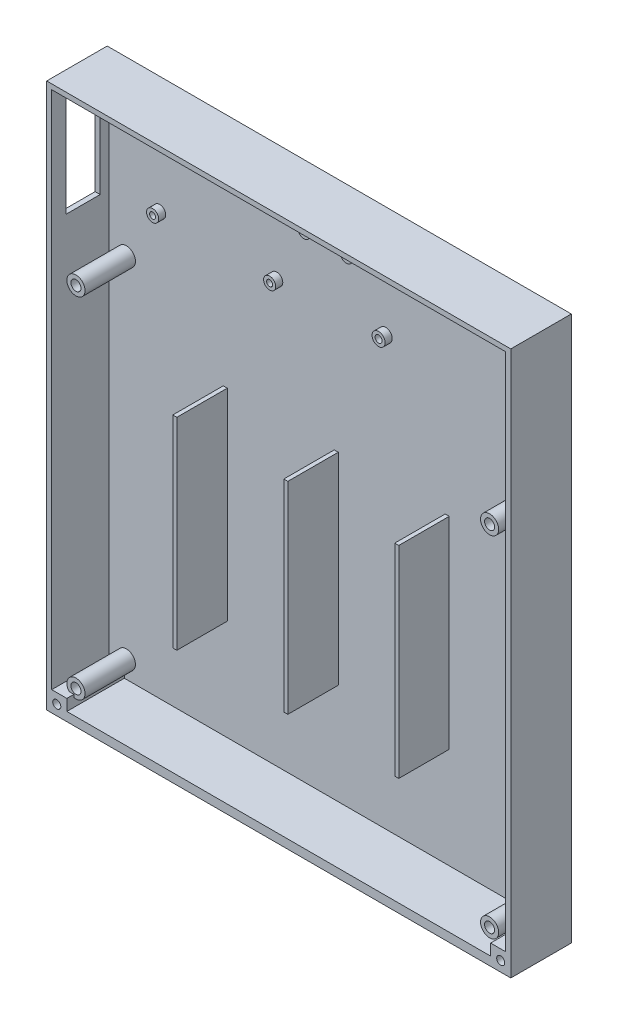
from build123d import *

# Parameters (mm, degrees)
ESQUISSE1_W             = 230
ESQUISSE1_H             = 270
BOSS_EXTRU_1_DEPTH      = 5
ESQUISSE2_R             = 2
ESQUISSE2_R_2           = 1.75
ESQUISSE2_R_3           = 1.5
ENL_V_MAT_EXTRU_1_DEPTH = 5
COQUE3_T                = -1.5
ESQUISSE3_R             = 4.5
ESQUISSE3_R_2           = 2.5
BOSS_EXTRU_3_DEPTH      = 25
ESQUISSE4_W             = 1
ESQUISSE4_H             = 267
BOSS_EXTRU_4_DEPTH      = 3.5
ESQUISSE5_W             = 225
ESQUISSE5_H             = 1
ESQUISSE5_H_2           = 2.9
BOSS_EXTRU_10_DEPTH     = 3.5
ESQUISSE7_W             = 2
ESQUISSE7_H             = 100
BOSS_EXTRU_11_DEPTH     = 25
ESQUISSE8_W             = 230
ESQUISSE8_H             = 270
ESQUISSE8_W_2           = 225
ESQUISSE8_H_2           = 263.1
BOSS_EXTRU_12_DEPTH     = 25
ESQUISSE13_W            = 17
ESQUISSE13_H            = 55
ENL_V_MAT_EXTRU_4_DEPTH = 10
ESQUISSE16_W            = 7.5
ESQUISSE16_H            = 5.6
BOSS_EXTRU_13_DEPTH     = 28.5
ESQUISSE17_R            = 2
ENL_V_MAT_EXTRU_5_DEPTH = 213.83636063


with BuildPart() as part:
    # Esquisse1 → Boss.-Extru.1 (new body)
    with BuildSketch(Plane.XY):
        with Locations((0, -41.5625)):
            Rectangle(ESQUISSE1_W, ESQUISSE1_H)
    extrude(amount=BOSS_EXTRU_1_DEPTH)

    # Esquisse2 → Enlèv. mat.-Extru.1 (cut)
    with BuildSketch(Plane.XY.offset(5)):
        with Locations((-104, -163.5625)):
            Circle(ESQUISSE2_R)
        with Locations(Location((-104, 9.4375, 0), (0, 0, 180))):
            Circle(ESQUISSE2_R)
        with Locations((104.5, 82.9375)):
            Circle(ESQUISSE2_R_2)
        with Locations((24.5, 82.9375)):
            Circle(ESQUISSE2_R_2)
        with Locations(Location((24.5, 39.9375, 0), (0, 0, 180))):
            Circle(ESQUISSE2_R_2)
        with Locations(Location((104.5, 39.9375, 0), (0, 0, 180))):
            Circle(ESQUISSE2_R_2)
        with Locations((-87.5, 85.9375)):
            Circle(ESQUISSE2_R_3)
        with Locations(Location((-29.5, 85.9375, 0), (0, 0, 180))):
            Circle(ESQUISSE2_R_3)
        with Locations((8.5, 67.4375)):
            Circle(ESQUISSE2_R_3)
        with Locations(Location((-12.5, 67.4375, 0), (0, 0, 180))):
            Circle(ESQUISSE2_R_3)
        with Locations((-12.5, 79.9375)):
            Circle(ESQUISSE2_R_3)
        with Locations(Location((8.5, 79.9375, 0), (0, 0, 180))):
            Circle(ESQUISSE2_R_3)
        with Locations(Location((101, -163.5625, 0), (0, 0, 180))):
            Circle(ESQUISSE2_R)
        with Locations((101, 9.4375)):
            Circle(ESQUISSE2_R)
        with Locations(Location((-87.5, 36.9375, 0), (0, 0, 180))):
            Circle(ESQUISSE2_R_3)
        with Locations((-29.5, 36.9375)):
            Circle(ESQUISSE2_R_3)
    extrude(amount=-ENL_V_MAT_EXTRU_1_DEPTH, mode=Mode.SUBTRACT)

    # Coque3
    coque3_openings = [part.faces().sort_by_distance(p)[0] for p in [
        (-0.011238138, -41.697281592, 5),
    ]]
    offset(amount=COQUE3_T, openings=coque3_openings, kind=Kind.INTERSECTION)

    # Esquisse3 → Boss.-Extru.3 (add)
    # profile 1 of 4: a face of its own
    with BuildSketch(Plane.XY.offset(1.5)):
        with Locations(Location((-104, 9.4375, 0), (0, 0, 180))):
            Circle(ESQUISSE3_R)
        with Locations(Location((-104, 9.4375, 0), (0, 0, 180))):
            Circle(ESQUISSE3_R_2, mode=Mode.SUBTRACT)
    # profile 2 of 4: a face of its own
    with BuildSketch(Plane.XY.offset(1.5)):
        with Locations(Location((-104, -163.5625, 0), (0, 0, 180))):
            Circle(ESQUISSE3_R)
        with Locations(Location((-104, -163.5625, 0), (0, 0, 180))):
            Circle(ESQUISSE3_R_2, mode=Mode.SUBTRACT)
    # profile 3 of 4: a face of its own
    with BuildSketch(Plane.XY.offset(1.5)):
        with Locations(Location((101, -163.5625, 0), (0, 0, 180))):
            Circle(ESQUISSE3_R)
        with Locations(Location((101, -163.5625, 0), (0, 0, 180))):
            Circle(ESQUISSE3_R_2, mode=Mode.SUBTRACT)
    # profile 4 of 4: a face of its own
    with BuildSketch(Plane.XY.offset(1.5)):
        with Locations(Location((101, 9.4375, 0), (0, 0, 180))):
            Circle(ESQUISSE3_R)
        with Locations(Location((101, 9.4375, 0), (0, 0, 180))):
            Circle(ESQUISSE3_R_2, mode=Mode.SUBTRACT)
    extrude(amount=BOSS_EXTRU_3_DEPTH)

    # Esquisse4 → Boss.-Extru.4 (add)
    with BuildSketch(Plane.XY.offset(1.5)):
        with Locations((-113, -41.5625)):
            Rectangle(ESQUISSE4_W, ESQUISSE4_H)
        with Locations((113, -41.5625)):
            Rectangle(ESQUISSE4_W, ESQUISSE4_H)
    extrude(amount=BOSS_EXTRU_4_DEPTH)

    # Esquisse5 → Boss.-Extru.10 (add)
    with BuildSketch(Plane.XY.offset(1.5)):
        with Locations((0, 91.4375)):
            Rectangle(ESQUISSE5_W, ESQUISSE5_H)
        with Locations((0, -173.6125)):
            Rectangle(ESQUISSE5_W, ESQUISSE5_H_2)
    extrude(amount=BOSS_EXTRU_10_DEPTH)

    # Esquisse7 → Boss.-Extru.11 (add)
    with BuildSketch(Plane.XY.offset(1.5)):
        with Locations((0, -72.1625)):
            Rectangle(ESQUISSE7_W, ESQUISSE7_H)
        with Locations((-55, -72.1625)):
            Rectangle(ESQUISSE7_W, ESQUISSE7_H)
        with Locations((55, -72.1625)):
            Rectangle(ESQUISSE7_W, ESQUISSE7_H)
    extrude(amount=BOSS_EXTRU_11_DEPTH)

    # Esquisse8 → Boss.-Extru.12 (add)
    with BuildSketch(Plane.XY.offset(5)):
        with Locations((0, -41.5625)):
            Rectangle(ESQUISSE8_W, ESQUISSE8_H)
        with Locations((0, -40.6125)):
            Rectangle(ESQUISSE8_W_2, ESQUISSE8_H_2, mode=Mode.SUBTRACT)
    extrude(amount=BOSS_EXTRU_12_DEPTH)

    # Esquisse13 → Enlèv. mat.-Extru.4 (cut)
    with BuildSketch(Plane(origin=(-112.5, 0, 0), x_dir=(0, 0, -1), z_dir=(1, 0, 0))):
        with Locations((-14.5, 61.4375)):
            Rectangle(ESQUISSE13_W, ESQUISSE13_H)
    extrude(amount=-ENL_V_MAT_EXTRU_4_DEPTH, mode=Mode.SUBTRACT)

    # Esquisse16 → Boss.-Extru.13 (add)
    with BuildSketch(Plane.XY.offset(1.5)):
        with Locations((-108.75, -169.3625)):
            Rectangle(ESQUISSE16_W, ESQUISSE16_H)
        with Locations((108.75, -169.3625)):
            Rectangle(ESQUISSE16_W, ESQUISSE16_H)
    extrude(amount=BOSS_EXTRU_13_DEPTH)

    # Esquisse17 → Enlèv. mat.-Extru.5 (cut, through all)
    with BuildSketch(Plane.XY.offset(30)):
        with Locations((-110, -171.5625)):
            Circle(ESQUISSE17_R)
        with Locations((110, -171.5625)):
            Circle(ESQUISSE17_R)
    extrude(amount=-ENL_V_MAT_EXTRU_5_DEPTH, mode=Mode.SUBTRACT)


solid = part.part
